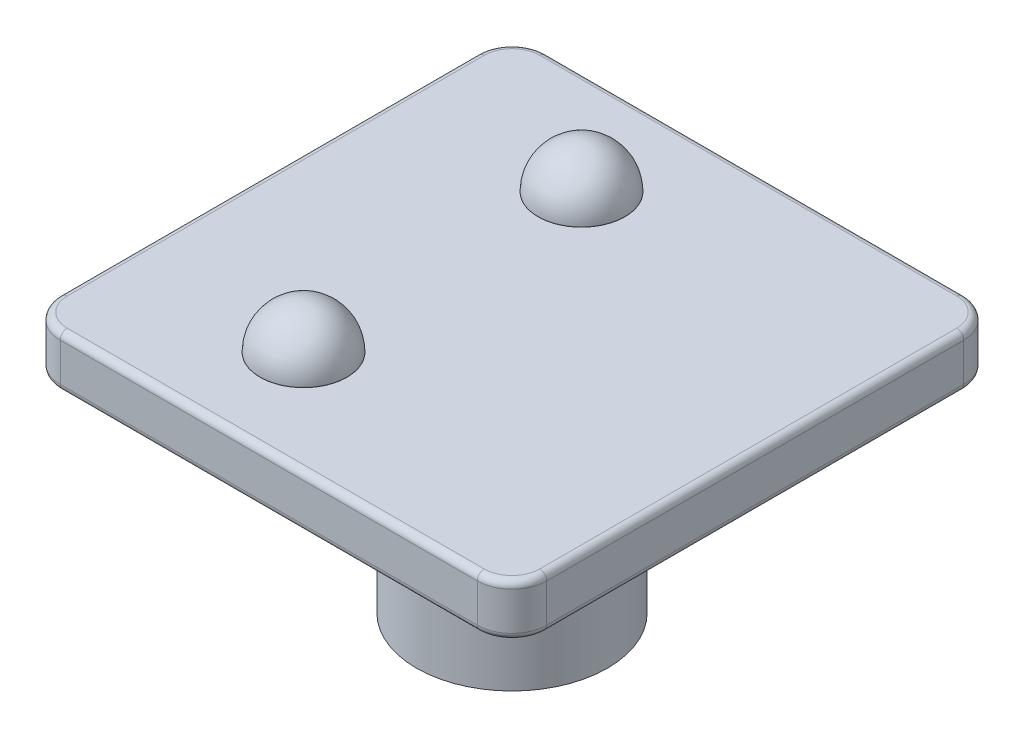
from build123d import *

# Parameters (mm, degrees)
BOSS_EXTRUDE1_DEPTH = 1.5
SKETCH2_R           = 2.75
BOSS_EXTRUDE2_DEPTH = 6
SKETCH3_W           = 1.1
SKETCH3_H           = 1.45
SKETCH3_W_2         = 1.45
SKETCH3_H_2         = 1.1
CUT_EXTRUDE1_DEPTH  = 6
CHAMFER1_SIZE       = 0.3
FILLET1_R           = 1
SKETCH4_R           = 1.25
BOSS_EXTRUDE3_DEPTH = 0.01
DOME1_FACE_RADIUS   = 1.25
DOME1_HEIGHT        = 1.25
DOME5_FACE_RADIUS   = 1.25
DOME5_HEIGHT        = 1.25
FILLET3_R           = 0.2


with BuildPart() as part:
    # Sketch1 → Boss-Extrude1 (new body)
    with BuildSketch(Plane(origin=(0, 0, 0), x_dir=(1, 0, 0), z_dir=(0, 1, 0))):
        with BuildLine():
            Line((-7.324675649, 4.396717546), (4.675324351, 4.396717546))
            ThreePointArc((4.675324351, 4.396717546), (5.382431132, 4.103824327), (5.675324351, 3.396717546))
            Line((5.675324351, 3.396717546), (5.675324351, -8.603282454))
            ThreePointArc((5.675324351, -8.603282454), (5.382431132, -9.310389235), (4.675324351, -9.603282454))
            Line((4.675324351, -9.603282454), (-7.324675649, -9.603282454))
            ThreePointArc((-7.324675649, -9.603282454), (-8.03178243, -9.310389235), (-8.324675649, -8.603282454))
            Line((-8.324675649, -8.603282454), (-8.324675649, 3.396717546))
            ThreePointArc((-8.324675649, 3.396717546), (-8.03178243, 4.103824327), (-7.324675649, 4.396717546))
        make_face()
    extrude(amount=BOSS_EXTRUDE1_DEPTH)

    # Sketch2 → Boss-Extrude2 (add)
    with BuildSketch(Plane.XZ):
        with Locations(Location((-1.324675649, 2.603282454, 0), (0, 0, 270))):
            Circle(SKETCH2_R)
    extrude(amount=BOSS_EXTRUDE2_DEPTH)

    # Sketch3 → Cut-Extrude1 (cut)
    with BuildSketch(Plane.XZ.offset(6)):
        with Locations((-1.324675649, 3.878282454)):
            Rectangle(SKETCH3_W, SKETCH3_H)
        with Locations((-0.049675649, 2.603282454)):
            Rectangle(SKETCH3_W_2, SKETCH3_H_2)
        with Locations((-1.324675649, 2.603282454)):
            Rectangle(SKETCH3_W, SKETCH3_H_2)
        with Locations((-2.599675649, 2.603282454)):
            Rectangle(SKETCH3_W_2, SKETCH3_H_2)
        with Locations((-1.324675649, 1.328282454)):
            Rectangle(SKETCH3_W, SKETCH3_H)
    extrude(amount=-CUT_EXTRUDE1_DEPTH, mode=Mode.SUBTRACT)

    # Chamfer1
    chamfer1_edges = [part.edges().sort_by_distance(p)[0] for p in [
        (-0.774675649, -6, 3.878282454),
        (-0.049675649, -6, 3.153282454),
        (0.675324351, -6, 2.603282454),
        (-0.774675649, -6, 1.328282454),
        (-2.599675649, -6, 3.153282454),
        (-1.324675649, -6, 4.603282454),
        (-1.874675649, -6, 3.878282454),
        (-3.324675649, -6, 2.603282454),
        (-2.599675649, -6, 2.053282454),
        (-1.874675649, -6, 1.328282454),
        (-1.324675649, -6, 0.603282454),
        (-0.049675649, -6, 2.053282454),
    ]]
    chamfer(chamfer1_edges, length=CHAMFER1_SIZE)

    # Fillet1
    fillet1_edges = [part.edges().sort_by_distance(p)[0] for p in [
        (-1.324675649, 0, 5.353282454),
    ]]
    fillet(fillet1_edges, radius=FILLET1_R)

    # Sketch4 → Boss-Extrude3 (add)
    with BuildSketch(Plane(origin=(0, 1.5, 0), x_dir=(1, 0, 0), z_dir=(0, 1, 0))):
        with Locations(Location((-3.324675649, 1.396717546, 0), (0, 0, 90))):
            Circle(SKETCH4_R)
        with Locations(Location((-3.324675649, -6.603282454, 0), (0, 0, 90))):
            Circle(SKETCH4_R)
    extrude(amount=BOSS_EXTRUDE3_DEPTH)

    # Dome1: a dome of height H over a round flat face of radius A is a cap of a sphere of radius (A * A + H * H) / (2 * H)
    dome1_r = (DOME1_FACE_RADIUS * DOME1_FACE_RADIUS + DOME1_HEIGHT * DOME1_HEIGHT) / (2 * DOME1_HEIGHT)
    dome1_base = Plane((-3.324675649, 1.51, -1.396717546), z_dir=(0, 1, 0))
    with Locations(dome1_base.offset(DOME1_HEIGHT - dome1_r)):
        dome1_ball = Sphere(dome1_r, mode=Mode.PRIVATE)
    add(split(dome1_ball, bisect_by=dome1_base, keep=Keep.TOP, mode=Mode.PRIVATE))

    # Dome5: a dome of height H over a round flat face of radius A is a cap of a sphere of radius (A * A + H * H) / (2 * H)
    dome5_r = (DOME5_FACE_RADIUS * DOME5_FACE_RADIUS + DOME5_HEIGHT * DOME5_HEIGHT) / (2 * DOME5_HEIGHT)
    dome5_base = Plane((-3.324675649, 1.51, 6.603282454), z_dir=(0, 1, 0))
    with Locations(dome5_base.offset(DOME5_HEIGHT - dome5_r)):
        dome5_ball = Sphere(dome5_r, mode=Mode.PRIVATE)
    add(split(dome5_ball, bisect_by=dome5_base, keep=Keep.TOP, mode=Mode.PRIVATE))

    # Fillet3
    fillet3_edges = [part.edges().sort_by_distance(p)[0] for p in [
        (5.382431132, 1.5, 9.310389235),
        (-1.324675649, 0, 9.603282454),
        (-8.03178243, 0, 9.310389235),
        (5.675324351, 1.5, 2.603282454),
        (5.382431132, 1.5, -4.103824327),
        (-1.324675649, 1.5, -4.396717546),
        (-8.03178243, 1.5, -4.103824327),
        (-8.324675649, 1.5, 2.603282454),
        (-8.03178243, 1.5, 9.310389235),
        (-1.324675649, 1.5, 9.603282454),
        (-8.324675649, 0, 2.603282454),
        (-8.03178243, 0, -4.103824327),
        (-1.324675649, 0, -4.396717546),
        (5.382431132, 0, -4.103824327),
        (5.675324351, 0, 2.603282454),
        (5.382431132, 0, 9.310389235),
    ]]
    fillet(fillet3_edges, radius=FILLET3_R)


solid = part.part
